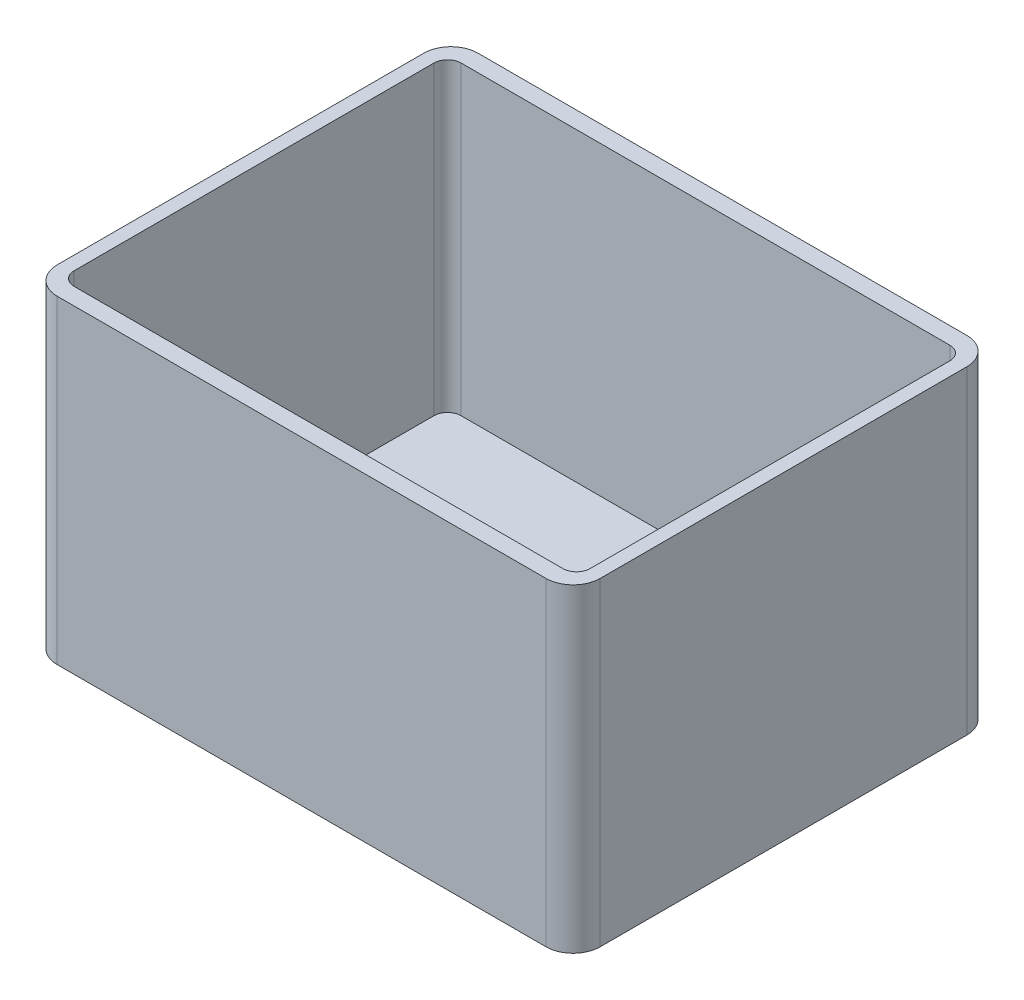
from build123d import *

# Parameters (mm, degrees)
BOSS_EXTRUDE1_DEPTH = 235
CUT_EXTRUDE1_DEPTH  = 225


with BuildPart() as part:
    # Sketch1 → Boss-Extrude1 (new body)
    with BuildSketch(Plane(origin=(0, 0, 0), x_dir=(1, 0, 0), z_dir=(0, 1, 0))):
        with BuildLine():
            Line((-180, -155), (180, -155))
            ThreePointArc((180, -155), (194.142135624, -149.142135624), (200, -135))
            Line((200, -135), (200, 135))
            ThreePointArc((200, 135), (194.142135624, 149.142135624), (180, 155))
            Line((180, 155), (-180, 155))
            ThreePointArc((-180, 155), (-194.142135624, 149.142135624), (-200, 135))
            Line((-200, 135), (-200, -135))
            ThreePointArc((-200, -135), (-194.142135624, -149.142135624), (-180, -155))
        make_face()
    extrude(amount=BOSS_EXTRUDE1_DEPTH)

    # Sketch2 → Cut-Extrude1 (cut)
    with BuildSketch(Plane(origin=(0, 235, 0), x_dir=(1, 0, 0), z_dir=(0, 1, 0))):
        with BuildLine():
            Line((-180, -142.5), (180, -142.5))
            ThreePointArc((180, -142.5), (187.071067812, -139.571067812), (190, -132.5))
            Line((190, -132.5), (190, 132.5))
            ThreePointArc((190, 132.5), (187.071067812, 139.571067812), (180, 142.5))
            Line((180, 142.5), (-180, 142.5))
            ThreePointArc((-180, 142.5), (-187.071067812, 139.571067812), (-190, 132.5))
            Line((-190, 132.5), (-190, -132.5))
            ThreePointArc((-190, -132.5), (-187.071067812, -139.571067812), (-180, -142.5))
        make_face()
    extrude(amount=-CUT_EXTRUDE1_DEPTH, mode=Mode.SUBTRACT)


solid = part.part
